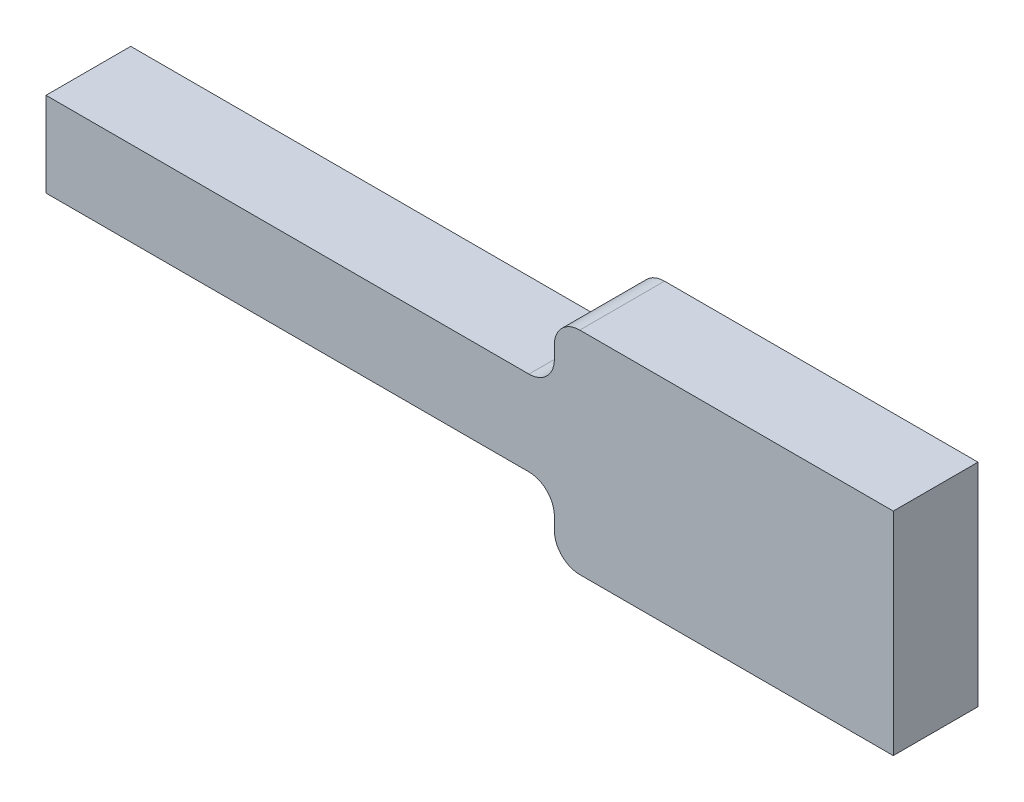
from build123d import *

# Parameters (mm, degrees)
SKETCH2_W               = 100
SKETCH2_H               = 10
BOSS_EXTRUDE2_DEPTH     = 12.5
CUT_EXTRUDE3_DEPTH      = 53.5
CUT_EXTRUDE3_DEPTH_BACK = 53.5
SKETCH6_W               = 60
SKETCH6_H               = 7.5
FILLET2_R               = 3


with BuildPart() as part:
    # Sketch2 → Boss-Extrude2 (new, symmetric)
    with BuildSketch(Plane(origin=(0, 0, 0), x_dir=(1, 0, 0), z_dir=(0, 1, 0))):
        Rectangle(SKETCH2_W, SKETCH2_H)
    extrude(amount=BOSS_EXTRUDE2_DEPTH, both=True)

    # Sketch6 → Cut-Extrude3 (cut, two sides: drawn at the far end of the back side and taken through both)
    with BuildSketch(Plane.XY.offset(5).offset(-CUT_EXTRUDE3_DEPTH_BACK)):
        with Locations((-20, 8.75)):
            Rectangle(SKETCH6_W, SKETCH6_H)
        with Locations((-20, -8.75)):
            Rectangle(SKETCH6_W, SKETCH6_H)
    extrude(amount=CUT_EXTRUDE3_DEPTH + CUT_EXTRUDE3_DEPTH_BACK, mode=Mode.SUBTRACT)

    # Fillet2
    fillet2_edges = [part.edges().sort_by_distance(p)[0] for p in [
        (10, 5, 0),
        (10, 12.5, 0),
        (10, -12.5, 0),
        (10, -5, 0),
    ]]
    fillet(fillet2_edges, radius=FILLET2_R)


solid = part.part
